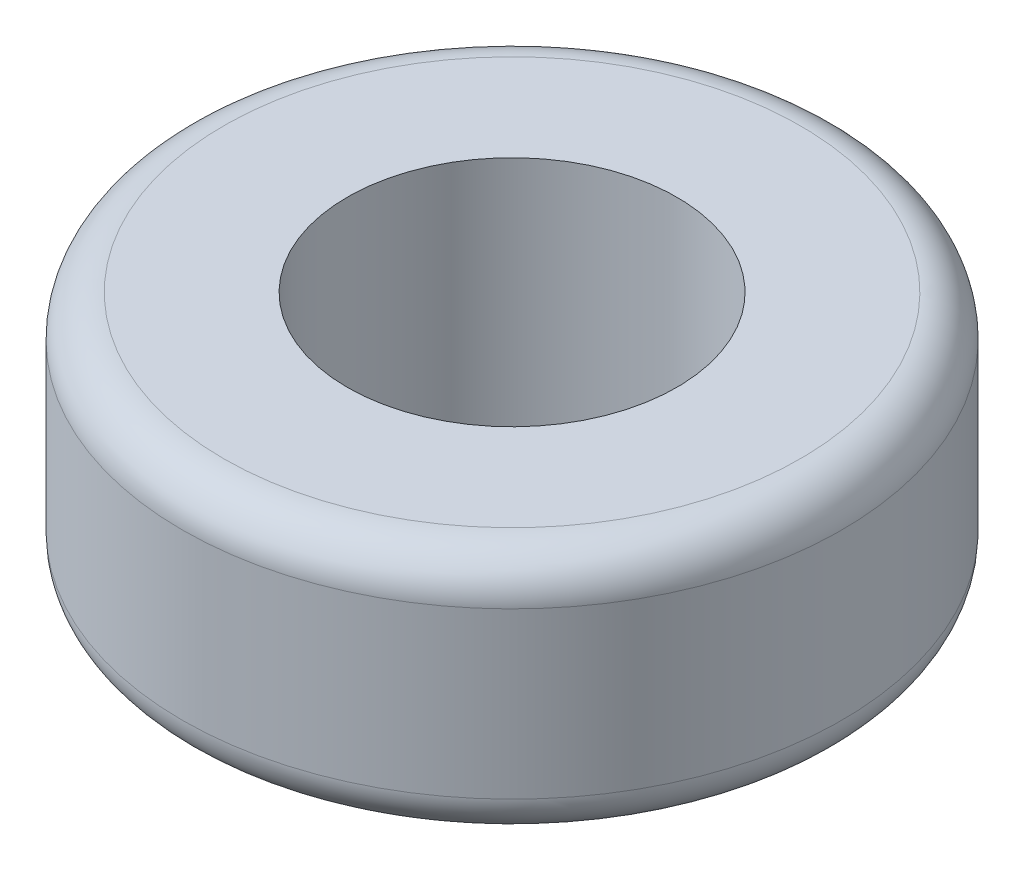
from build123d import *

# Parameters (mm, degrees)
SKETCH1_R           = 4
SKETCH1_R_2         = 2
BOSS_EXTRUDE1_DEPTH = 3
FILLET1_R           = 0.5


with BuildPart() as part:
    # Sketch1 → Boss-Extrude1 (new body)
    with BuildSketch(Plane(origin=(0, 0, 0), x_dir=(1, 0, 0), z_dir=(0, 1, 0))):
        with Locations(Location((0, 0, 0), (0, 0, 270))):
            Circle(SKETCH1_R)
        with Locations(Location((0, 0, 0), (0, 0, 270))):
            Circle(SKETCH1_R_2, mode=Mode.SUBTRACT)
    extrude(amount=BOSS_EXTRUDE1_DEPTH)

    # Fillet1
    fillet1_edges = [part.edges().sort_by_distance(p)[0] for p in [
        (0, 0, -4),
        (0, 3, -4),
    ]]
    fillet(fillet1_edges, radius=FILLET1_R)


solid = part.part
